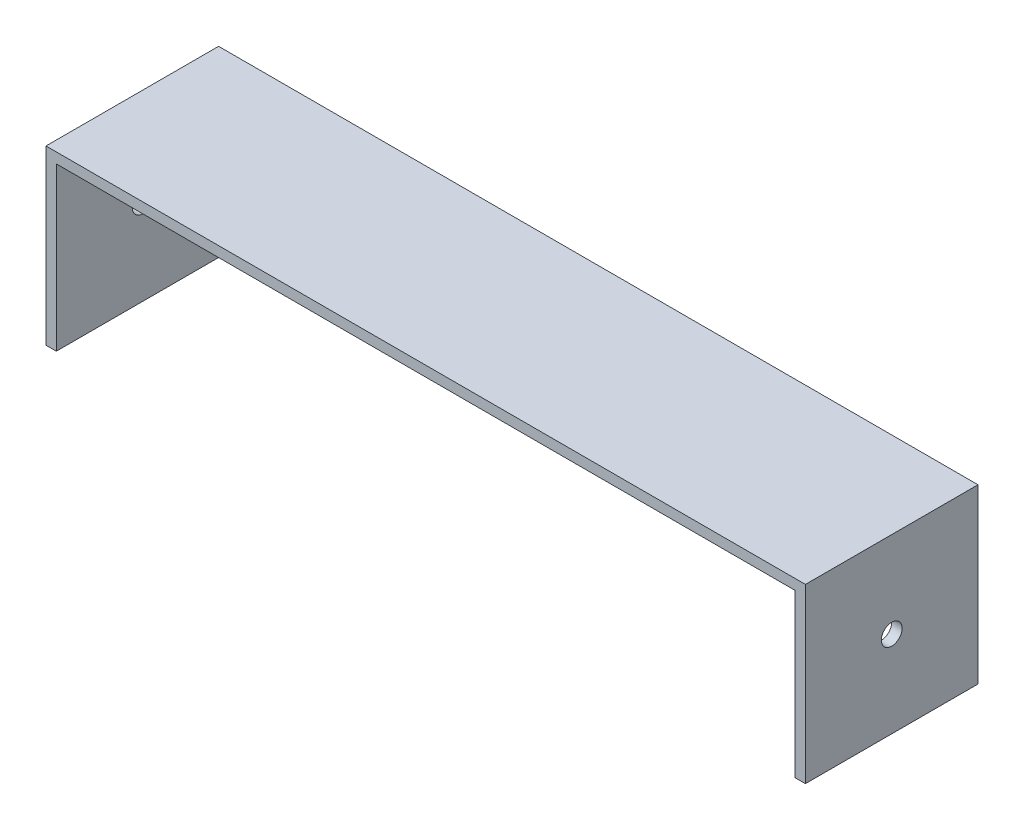
from build123d import *

# Parameters (mm, degrees)
SKETCH3_W           = 107
SKETCH3_H           = 25
BOSS_EXTRUDE1_DEPTH = 1.5
SKETCH3_3_W         = 1.5
SKETCH3_3_H         = 25
BOSS_EXTRUDE2_DEPTH = 25
SKETCH4_R           = 1.5
CUT_EXTRUDE1_DEPTH  = 114.495594628


with BuildPart() as part:
    # Sketch3 → Boss-Extrude1 (new body)
    with BuildSketch(Plane(origin=(0, 0, 0), x_dir=(1, 0, 0), z_dir=(0, 1, 0))):
        Rectangle(SKETCH3_W, SKETCH3_H)
    extrude(amount=-BOSS_EXTRUDE1_DEPTH)

    # Sketch3<3> → Boss-Extrude2 (add)
    with BuildSketch(Plane(origin=(0, 0, 0), x_dir=(1, 0, 0), z_dir=(0, 1, 0))):
        with Locations((-54.25, 0)):
            Rectangle(SKETCH3_3_W, SKETCH3_3_H)
        with Locations((54.25, 0)):
            Rectangle(SKETCH3_3_W, SKETCH3_3_H)
    extrude(amount=-BOSS_EXTRUDE2_DEPTH)

    # Sketch4 → Cut-Extrude1 (cut, through all)
    with BuildSketch(Plane(origin=(55, 0, 0), x_dir=(0, 0, -1), z_dir=(1, 0, 0))):
        with Locations((0, -12.5)):
            Circle(SKETCH4_R)
    extrude(amount=-CUT_EXTRUDE1_DEPTH, mode=Mode.SUBTRACT)


solid = part.part
